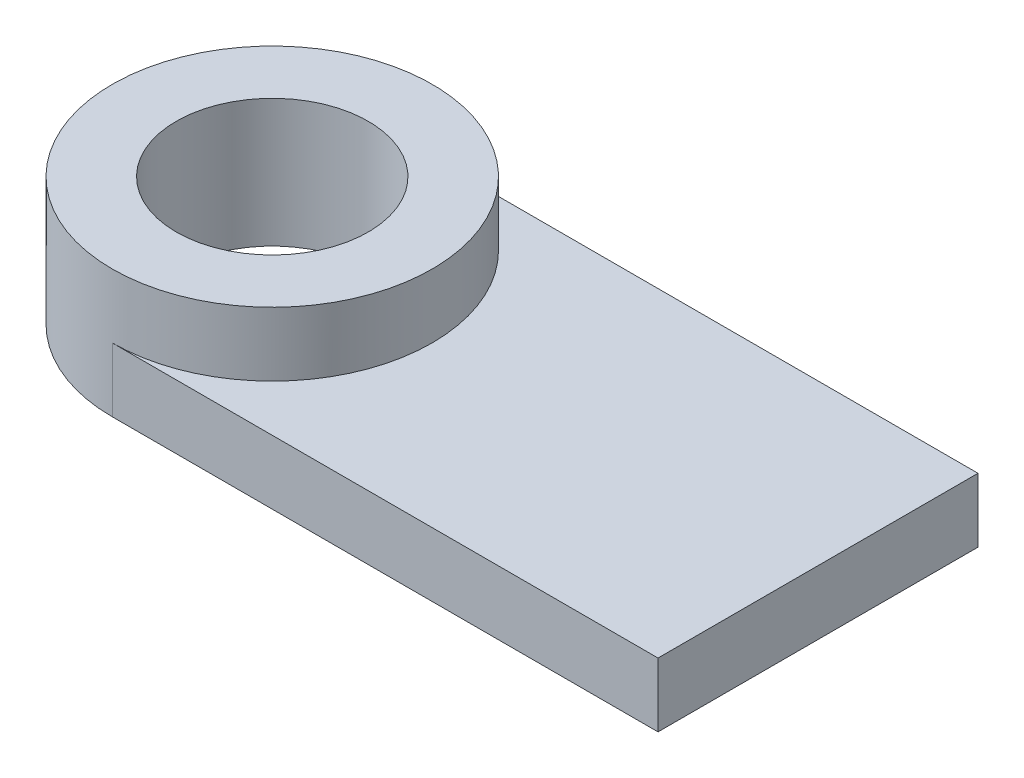
from build123d import *

# Parameters (mm, degrees)
SKETCH1_R           = 9.525
BOSS_EXTRUDE1_DEPTH = 12.7
BOSS_EXTRUDE2_DEPTH = 6.35


with BuildPart() as part:
    # Sketch1 → Boss-Extrude1 (new body)
    with BuildSketch(Plane(origin=(0, 0, 0), x_dir=(1, 0, 0), z_dir=(0, 1, 0))):
        with BuildLine():
            ThreePointArc((0, 15.875), (-15.875, 0), (0, -15.875))
            ThreePointArc((0, -15.875), (11.225320151, -11.225320151), (15.875, 0))
            ThreePointArc((15.875, 0), (11.225320151, 11.225320151), (0, 15.875))
        make_face()
        Circle(SKETCH1_R, mode=Mode.SUBTRACT)
    extrude(amount=BOSS_EXTRUDE1_DEPTH)

    # Sketch1<6> → Boss-Extrude2 (add)
    with BuildSketch(Plane(origin=(0, 0, 0), x_dir=(1, 0, 0), z_dir=(0, 1, 0))):
        with BuildLine():
            ThreePointArc((15.875, 0), (11.225320151, -11.225320151), (0, -15.875))
            Line((0, -15.875), (54.154575014, -15.875))
            Line((54.154575014, -15.875), (54.154575014, 15.875))
            Line((54.154575014, 15.875), (0, 15.875))
            ThreePointArc((0, 15.875), (11.225320151, 11.225320151), (15.875, 0))
        make_face()
    extrude(amount=BOSS_EXTRUDE2_DEPTH)


solid = part.part
